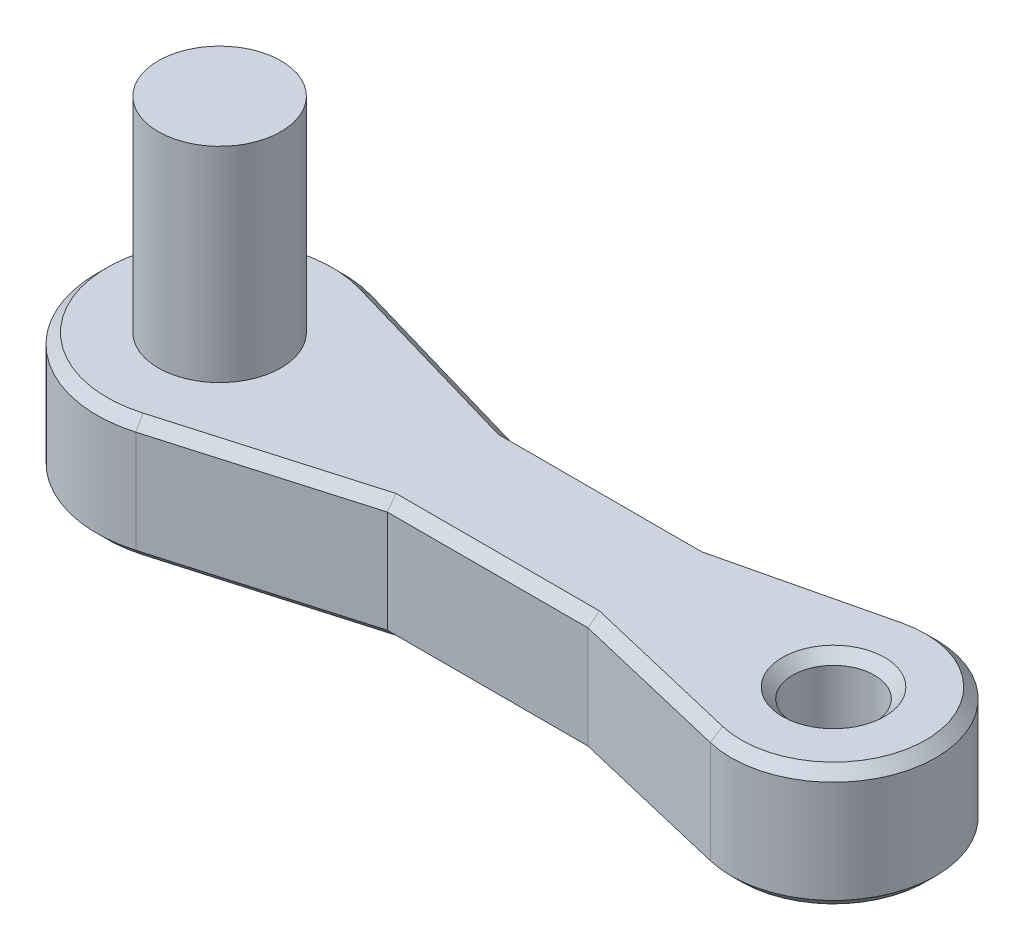
from build123d import *

# Parameters (mm, degrees)
SKETCH_1_R          = 1.5
EXTRUDE_1_DEPTH     = 5
EXTRUDE_3_DEPTH     = 3
SKETCH_5_R          = 1
CUT_EXTRUDE_2_DEPTH = 3
EXTRUDE_4_DEPTH     = 3
EXTRUDE_5_DEPTH     = 3
CHAMFER_2_SIZE      = 0.25


with BuildPart() as part:
    # 草图1 → 凸台-拉伸1 (new body)
    with BuildSketch(Plane(origin=(0, 0, 0), x_dir=(1, 0, 0), z_dir=(0, 1, 0))):
        with Locations(Location((0, 0, 0), (0, 0, 270))):
            Circle(SKETCH_1_R)
    extrude(amount=EXTRUDE_1_DEPTH)

    # 草图4 → 凸台-拉伸3 (add)
    with BuildSketch(Plane(origin=(0, 0, 0), x_dir=(1, 0, 0), z_dir=(0, 1, 0))):
        with BuildLine():
            Line((2.598076211, 1.5), (13, 1.5))
            ThreePointArc((13, 1.5), (17.5, 0), (13, -1.5))
            Line((13, -1.5), (2.598076211, -1.5))
            ThreePointArc((2.598076211, -1.5), (-3, 0), (2.598076211, 1.5))
        make_face()
    extrude(amount=-EXTRUDE_3_DEPTH)

    # 草图5 → 切除-拉伸2 (cut)
    with BuildSketch(Plane(origin=(0, 0, 0), x_dir=(1, 0, 0), z_dir=(0, 1, 0))):
        with Locations(Location((15, 0, 0), (0, 0, 270))):
            Circle(SKETCH_5_R)
    extrude(amount=-CUT_EXTRUDE_2_DEPTH, mode=Mode.SUBTRACT)

    # 草图7 → 凸台-拉伸4 (add)
    with BuildSketch(Plane(origin=(0, 0, 0), x_dir=(1, 0, 0), z_dir=(0, 1, 0))):
        with BuildLine():
            Line((10.5, 1.5), (14.421854812, 2.432231104))
            ThreePointArc((14.421854812, 2.432231104), (13.629244055, 2.090700395), (13, 1.5))
            Line((13, 1.5), (10.5, 1.5))
        make_face()
        with BuildLine():
            Line((10.5, -1.5), (14.421854812, -2.432231104))
            ThreePointArc((14.421854812, -2.432231104), (13.629244055, -2.090700395), (13, -1.5))
            Line((13, -1.5), (10.5, -1.5))
        make_face()
    extrude(amount=-EXTRUDE_4_DEPTH)

    # 草图9 → 凸台-拉伸5 (add)
    with BuildSketch(Plane(origin=(0, 0, 0), x_dir=(1, 0, 0), z_dir=(0, 1, 0))):
        with BuildLine():
            Line((5.598076211, 1.5), (2.598076211, 1.5))
            ThreePointArc((2.598076211, 1.5), (1.850570943, 2.36122578), (0.835663526, 2.881261264))
            Line((0.835663526, 2.881261264), (5.598076211, 1.5))
        make_face()
        with BuildLine():
            Line((2.598076211, -1.5), (5.598076211, -1.5))
            Line((5.598076211, -1.5), (0.835663526, -2.881261264))
            ThreePointArc((0.835663526, -2.881261264), (1.850570943, -2.36122578), (2.598076211, -1.5))
        make_face()
    extrude(amount=-EXTRUDE_5_DEPTH)

    # 倒角2
    chamfer_2_edges = [part.edges().sort_by_distance(p)[0] for p in [
        (15, 0, -1),
        (15, -3, -1),
        (17.5, 0, 0),
        (17.5, -3, 0),
        (12.460927406, 0, 1.966115552),
        (12.460927406, -3, 1.966115552),
        (8.049038106, 0, -1.5),
        (8.049038106, -3, -1.5),
        (12.460927406, 0, -1.966115552),
        (12.460927406, -3, -1.966115552),
        (-3, 0, 0),
        (-3, -3, 0),
        (3.216869869, 0, -2.190630632),
        (3.216869869, -3, -2.190630632),
        (8.049038106, 0, 1.5),
        (8.049038106, -3, 1.5),
        (3.216869869, 0, 2.190630632),
        (3.216869869, -3, 2.190630632),
    ]]
    chamfer(chamfer_2_edges, length=CHAMFER_2_SIZE)


solid = part.part
